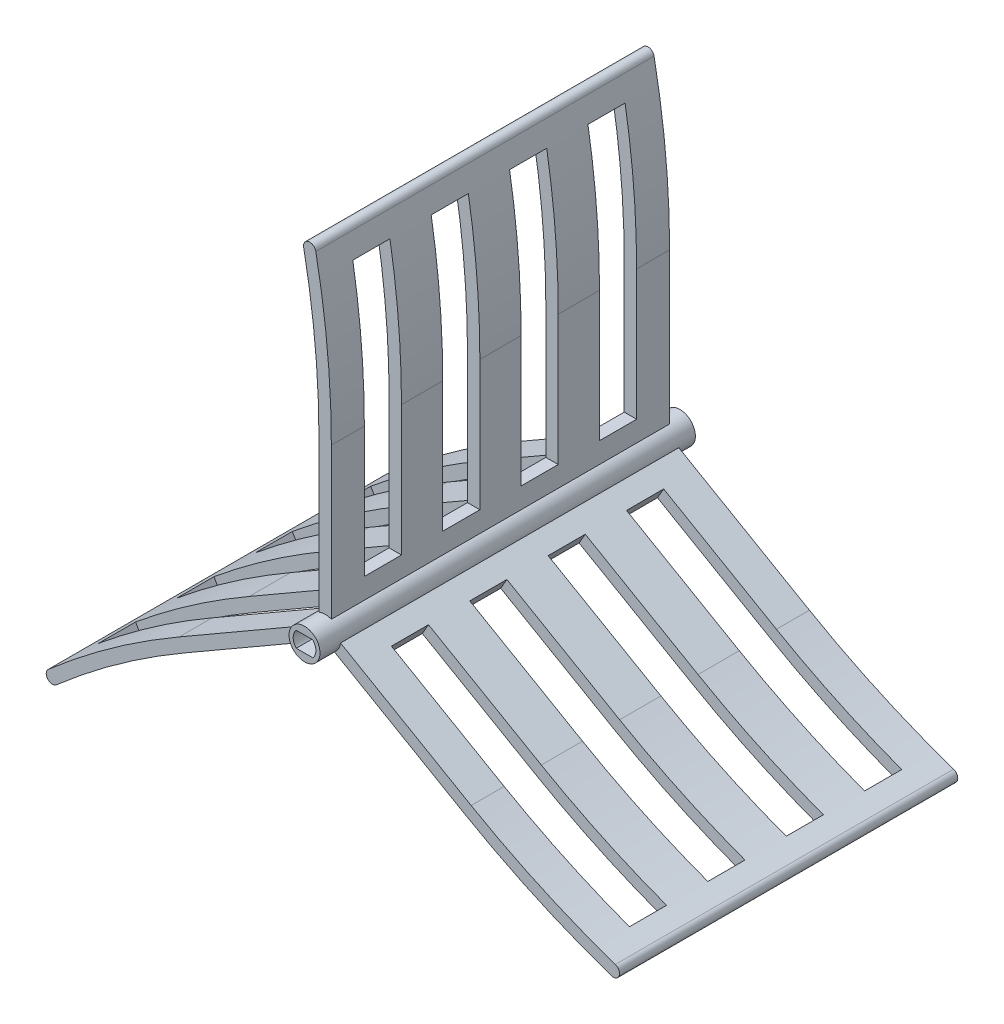
from build123d import *

# Parameters (mm, degrees)
SKETCH_1_R               = 3.75
EXTRUDE_1_DEPTH          = 91
CUT_EXTRUDE_1_DEPTH      = 9
SKETCH_4_R               = 2.5
EXTRUDE_2_DEPTH          = 6
EXTRUDE_START            = -4
EXTRUDE_3_DEPTH          = 82
SKETCH_10_R              = 2.5
EXTRUDE_4_DEPTH          = 2
EXTRUDE_START_2          = 3
EXTRUDE_5_DEPTH          = 3
EXTRUDE_START_3          = 1.5
EXTRUDE_6_DEPTH          = 1.5
CUT_EXTRUDE_4_DEPTH      = 0.5
CUT_EXTRUDE_START        = -8
SKETCH_14_R              = 2.5
CUT_EXTRUDE_5_DEPTH      = 8
CUT_EXTRUDE_9_DEPTH      = 8
CUT_EXTRUDE_10_REACH     = 123.353
SKETCH_16_W              = 9
SKETCH_16_H              = 65
PATTERN_CIRCULAR_1_COUNT = 3
PATTERN_CIRCULAR_2_COUNT = 3


with BuildPart() as part:
    # 草图1 → 凸台-拉伸1 (new body)
    with BuildSketch(Plane.XY):
        Circle(SKETCH_1_R)
    extrude(amount=EXTRUDE_1_DEPTH)

    # 草图2 → 切除-拉伸1 (cut)
    with BuildSketch(Plane(origin=(0, 0, 0), x_dir=(-1, 0, 0), z_dir=(0, 0, -1))):
        with BuildLine():
            Line((-2, 1.887458609), (2, 1.887458609))
            ThreePointArc((2, 1.887458609), (2.75, 0), (2, -1.887458609))
            Line((2, -1.887458609), (-2, -1.887458609))
            ThreePointArc((-2, -1.887458609), (-2.75, 0), (-2, 1.887458609))
        make_face()
    extrude(amount=-CUT_EXTRUDE_1_DEPTH, mode=Mode.SUBTRACT)

    # 草图4 → 凸台-拉伸2 (add)
    with BuildSketch(Plane.XY.offset(91)):
        Circle(SKETCH_4_R)
    extrude(amount=EXTRUDE_2_DEPTH)

    # 草图7 → 凸台-拉伸3 (add)
    with BuildSketch(Plane(origin=(0, 0, 0), x_dir=(-1, 0, 0), z_dir=(0, 0, -1)).offset(EXTRUDE_START)):
        with BuildLine():
            ThreePointArc((-1.5, 3.436931771), (-0.766161164, 3.670898673), (0, 3.75))
            ThreePointArc((0, 3.75), (0.766161164, 3.670898673), (1.5, 3.436931771))
            Line((1.5, 3.436931771), (1.5, 40))
            ThreePointArc((1.5, 40), (2.430132962, 59.193687469), (5.211814999, 78.207499055))
            ThreePointArc((5.211814999, 78.207499055), (5.212182881, 78.20937453), (5.212550781, 78.21125))
            ThreePointArc((5.212550781, 78.21125), (4.02935532, 79.97194546), (2.26865986, 78.78875))
            ThreePointArc((2.26865986, 78.78875), (-0.555622008, 59.485699395), (-1.5, 40))
            Line((-1.5, 40), (-1.5, 3.436931771))
        make_face()
    extrude_3 = extrude(amount=-EXTRUDE_3_DEPTH)

    # 草图10 → 凸台-拉伸4 (add)
    with BuildSketch(Plane.XY.offset(97)):
        Circle(SKETCH_10_R)
    extrude(amount=EXTRUDE_4_DEPTH)

    # 草图11 → 凸台-拉伸5 (add)
    with BuildSketch(Plane(origin=(0, 0, 9), x_dir=(-1, 0, 0), z_dir=(0, 0, -1)).offset(EXTRUDE_START_2)):
        with BuildLine():
            Line((-2, -1.887458609), (2, -1.887458609))
            ThreePointArc((2, -1.887458609), (2.75, 0), (2, 1.887458609))
            Line((2, 1.887458609), (-2, 1.887458609))
            ThreePointArc((-2, 1.887458609), (-2.75, 0), (-2, -1.887458609))
        make_face()
    extrude(amount=-EXTRUDE_5_DEPTH)

    # 草图12 → 凸台-拉伸6 (add)
    with BuildSketch(Plane(origin=(0, 0, 6), x_dir=(-1, 0, 0), z_dir=(0, 0, -1)).offset(EXTRUDE_START_3)):
        with BuildLine():
            Line((-2, -1.887458609), (2, -1.887458609))
            ThreePointArc((2, -1.887458609), (2.75, 0), (2, 1.887458609))
            Line((2, 1.887458609), (-2, 1.887458609))
            ThreePointArc((-2, 1.887458609), (-2.75, 0), (-2, -1.887458609))
        make_face()
    extrude(amount=-EXTRUDE_6_DEPTH)

    # 草图13 → 切除-拉伸4 (cut)
    with BuildSketch(Plane(origin=(0, 0, 4.5), x_dir=(-1, 0, 0), z_dir=(0, 0, -1))):
        with BuildLine():
            Line((-2, -1.887458609), (2, -1.887458609))
            ThreePointArc((2, -1.887458609), (2.75, 0), (2, 1.887458609))
            Line((2, 1.887458609), (-2, 1.887458609))
            ThreePointArc((-2, 1.887458609), (-2.75, 0), (-2, -1.887458609))
        make_face()
    extrude(amount=-CUT_EXTRUDE_4_DEPTH, mode=Mode.SUBTRACT)

    # 草图14 → 切除-拉伸5 (cut)
    with BuildSketch(Plane.XY.offset(99).offset(CUT_EXTRUDE_START)):
        Circle(SKETCH_14_R)
    extrude(amount=CUT_EXTRUDE_5_DEPTH, mode=Mode.SUBTRACT)

    # 草图15 → 切除-拉伸9 (cut)
    with BuildSketch(Plane.XY.offset(91).offset(CUT_EXTRUDE_START)):
        with BuildLine():
            Line((-2, -1.887458609), (2, -1.887458609))
            ThreePointArc((2, -1.887458609), (2.75, 0), (2, 1.887458609))
            Line((2, 1.887458609), (-2, 1.887458609))
            ThreePointArc((-2, 1.887458609), (-2.75, 0), (-2, -1.887458609))
        make_face()
    extrude(amount=CUT_EXTRUDE_9_DEPTH, mode=Mode.SUBTRACT)

    # 草图16 → 切除-拉伸10 (cut, up to next)
    with BuildSketch(Plane(origin=(1.5, 0, 0), x_dir=(0, 0, -1), z_dir=(1, 0, 0)), mode=Mode.PRIVATE) as cut_extrude_10_sk1:
        with Locations((-73.5, 40.936931771)):
            Rectangle(SKETCH_16_W, SKETCH_16_H)
    cut_extrude_10_tool1 = extrude(cut_extrude_10_sk1.sketch, amount=-CUT_EXTRUDE_10_REACH, mode=Mode.PRIVATE) & part.part
    # 草图16 → 切除-拉伸10 (cut, up to next)
    with BuildSketch(Plane(origin=(1.5, 0, 0), x_dir=(0, 0, -1), z_dir=(1, 0, 0)), mode=Mode.PRIVATE) as cut_extrude_10_sk2:
        with Locations((-54.5, 40.936931771)):
            Rectangle(SKETCH_16_W, SKETCH_16_H)
    cut_extrude_10_tool2 = extrude(cut_extrude_10_sk2.sketch, amount=-CUT_EXTRUDE_10_REACH, mode=Mode.PRIVATE) & part.part
    # 草图16 → 切除-拉伸10 (cut, up to next)
    with BuildSketch(Plane(origin=(1.5, 0, 0), x_dir=(0, 0, -1), z_dir=(1, 0, 0)), mode=Mode.PRIVATE) as cut_extrude_10_sk3:
        with Locations((-35.5, 40.936931771)):
            Rectangle(SKETCH_16_W, SKETCH_16_H)
    cut_extrude_10_tool3 = extrude(cut_extrude_10_sk3.sketch, amount=-CUT_EXTRUDE_10_REACH, mode=Mode.PRIVATE) & part.part
    # 草图16 → 切除-拉伸10 (cut, up to next)
    with BuildSketch(Plane(origin=(1.5, 0, 0), x_dir=(0, 0, -1), z_dir=(1, 0, 0)), mode=Mode.PRIVATE) as cut_extrude_10_sk4:
        with Locations((-16.5, 40.936931771)):
            Rectangle(SKETCH_16_W, SKETCH_16_H)
    cut_extrude_10_tool4 = extrude(cut_extrude_10_sk4.sketch, amount=-CUT_EXTRUDE_10_REACH, mode=Mode.PRIVATE) & part.part
    cut_extrude_10_1 = cut_extrude_10_tool1.solids().sort_by_distance((1.5, 40.936932, 73.5))[0]
    add(cut_extrude_10_1, mode=Mode.SUBTRACT)
    cut_extrude_10_2 = cut_extrude_10_tool2.solids().sort_by_distance((1.5, 40.936932, 54.5))[0]
    add(cut_extrude_10_2, mode=Mode.SUBTRACT)
    cut_extrude_10_3 = cut_extrude_10_tool3.solids().sort_by_distance((1.5, 40.936932, 35.5))[0]
    add(cut_extrude_10_3, mode=Mode.SUBTRACT)
    cut_extrude_10_4 = cut_extrude_10_tool4.solids().sort_by_distance((1.5, 40.936932, 16.5))[0]
    add(cut_extrude_10_4, mode=Mode.SUBTRACT)
    cut_extrude_10 = cut_extrude_10_1 + cut_extrude_10_2 + cut_extrude_10_3 + cut_extrude_10_4  # 切除-拉伸10 as one shape, for the pattern or mirror that repeats it

    # 阵列(圆周)1: 凸台-拉伸3 ×3 about axis
    pattern_circular_1_axis = Axis((0, 0, 0), (0, 0, 1))
    for i in range(1, PATTERN_CIRCULAR_1_COUNT):
        add(extrude_3.rotate(pattern_circular_1_axis, i * 360 / PATTERN_CIRCULAR_1_COUNT))

    # 阵列(圆周)2: 切除-拉伸10 ×3 about axis
    pattern_circular_2_axis = Axis((0, 0, 0), (0, 0, 1))
    for i in range(1, PATTERN_CIRCULAR_2_COUNT):
        add(cut_extrude_10.rotate(pattern_circular_2_axis, i * 360 / PATTERN_CIRCULAR_2_COUNT), mode=Mode.SUBTRACT)


solid = part.part
